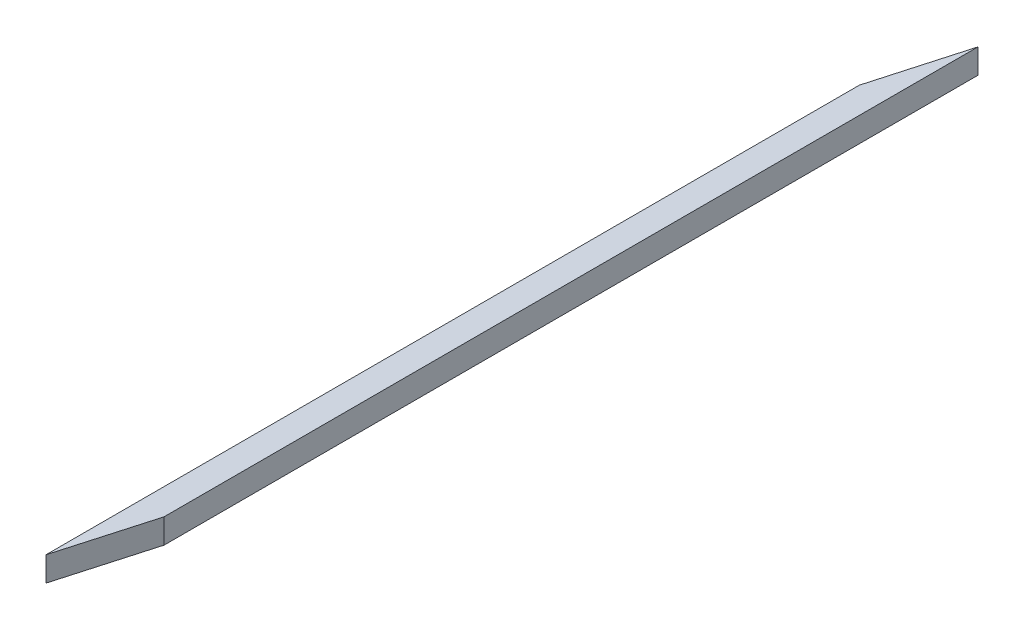
from build123d import *

# Parameters (mm, degrees)
SKETCH1_W           = 50
SKETCH1_H           = 47
BOSS_EXTRUDE1_DEPTH = 1734.59
CUT_EXTRUDE1_DEPTH  = 50


with BuildPart() as part:
    # Sketch1 → Boss-Extrude1 (new body)
    with BuildSketch(Plane.XY):
        with Locations((-23.125, -20.85)):
            Rectangle(SKETCH1_W, SKETCH1_H)
    extrude(amount=BOSS_EXTRUDE1_DEPTH)

    # Sketch2 → Cut-Extrude1 (cut)
    with BuildSketch(Plane(origin=(0, 2.65, 0), x_dir=(1, 0, 0), z_dir=(0, 1, 0))):
        Polygon((-48.125, 0), (-48.125, -176.790291198), (1.875, 0), align=None)
        Polygon((1.875, -1734.59), (1.965653572, -1555.619307002), (-48.917222904, -1734.364480175), align=None)
    extrude(amount=-CUT_EXTRUDE1_DEPTH, mode=Mode.SUBTRACT)


with BuildPart() as body_2:
    # of the pieces the cut leaves, the one that is kept (cut_extrude1_keep)
    add(part.part.solids().sort_by_distance((-48.125, 2.65, 176.790291198))[0])


solid = body_2.part
